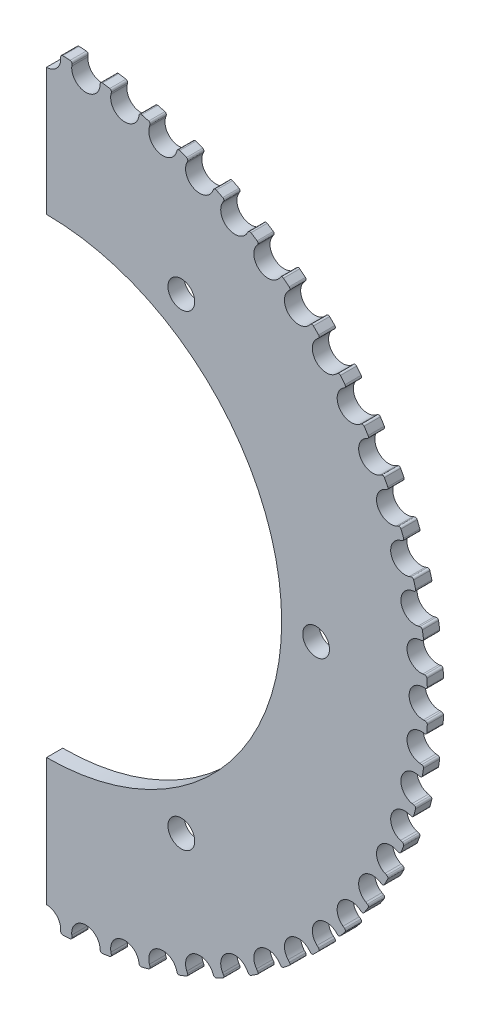
from build123d import *

# Parameters (mm, degrees)
SKETCH1_R                = 94
SKETCH1_R_2              = 58
BOSS_EXTRUDE1_DEPTH      = 4
CUT_EXTRUDE1_DEPTH       = 133.996240548
FILLET1_R                = 0.5
CIRPATTERN1_COUNT        = 60
FILLET1_OF_CIRPATTERN1_R = 0.5
M6_CLEARANCE_HOLE1_D     = 6.6
CIRPATTERN2_COUNT        = 6
CUT_EXTRUDE2_DEPTH       = 133.875237718
CUT_EXTRUDE2_DEPTH_BACK  = 133.875237718


with BuildPart() as part:
    # Sketch1 → Boss-Extrude1 (new body)
    with BuildSketch(Plane.XY):
        Circle(SKETCH1_R)
        Circle(SKETCH1_R_2, mode=Mode.SUBTRACT)
    extrude(amount=BOSS_EXTRUDE1_DEPTH)

    # Sketch2 → Cut-Extrude1 (cut, symmetric)
    with BuildSketch(Plane.XY):
        with BuildLine():
            Line((-3.5, 92.934817826), (-3.5, 93.934817826))
            ThreePointArc((-3.5, 93.934817826), (0, 94), (3.5, 93.934817826))
            Line((3.5, 93.934817826), (3.5, 92.934817826))
            ThreePointArc((3.5, 92.934817826), (0, 89.434817826), (-3.5, 92.934817826))
        make_face()
    cut_extrude1 = extrude(amount=CUT_EXTRUDE1_DEPTH, both=True, mode=Mode.SUBTRACT)

    # Fillet1
    fillet1_edges = [part.edges().sort_by_distance(p)[0] for p in [
        (3.5, 93.934817826, 2),
        (-3.5, 93.934817826, 2),
    ]]
    fillet(fillet1_edges, radius=FILLET1_R)

    # CirPattern1: Cut-Extrude1 ×60 about axis
    cirpattern1_axis = Axis((0, 0, 0), (0, 0, 1))
    for i in range(1, CIRPATTERN1_COUNT):
        add(cut_extrude1.rotate(cirpattern1_axis, i * 360 / CIRPATTERN1_COUNT), mode=Mode.SUBTRACT)

    # Fillet1 of CirPattern1
    fillet1_of_cirpattern1_edges = [part.edges().sort_by_distance(p)[0] for p in [
        (-6.338035521, 93.786082687, 2),
        (-13.299688788, 93.054383444, 2),
        (-16.106630198, 92.6098076, 2),
        (-22.953663403, 91.154425764, 2),
        (-25.698757265, 90.418880081, 2),
        (-32.356152879, 88.25576112, 2),
        (-35.009323369, 87.23730439, 2),
        (-41.404141572, 84.390147889, 2),
        (-43.93632, 83.099938537, 2),
        (-49.998497826, 79.599938537, 2),
        (-52.381941115, 78.052112368, 2),
        (-58.045060075, 73.937615602, 2),
        (-60.253654721, 72.149130922, 2),
        (-65.455668499, 67.465216677, 2),
        (-67.465216677, 65.455668499, 2),
        (-72.149130922, 60.253654721, 2),
        (-73.937615602, 58.045060075, 2),
        (-78.052112368, 52.381941115, 2),
        (-79.599938537, 49.998497826, 2),
        (-83.099938537, 43.93632, 2),
        (-84.390147889, 41.404141572, 2),
        (-87.23730439, 35.009323369, 2),
        (-88.25576112, 32.356152879, 2),
        (-90.418880081, 25.698757265, 2),
        (-91.154425764, 22.953663403, 2),
        (-92.6098076, 16.106630198, 2),
        (-93.054383444, 13.299688788, 2),
        (-93.786082687, 6.338035521, 2),
        (-93.934817826, 3.5, 2),
        (-93.934817826, -3.5, 2),
        (-93.786082687, -6.338035521, 2),
        (-93.054383444, -13.299688788, 2),
        (-92.6098076, -16.106630198, 2),
        (-91.154425764, -22.953663403, 2),
        (-90.418880081, -25.698757265, 2),
        (-88.25576112, -32.356152879, 2),
        (-87.23730439, -35.009323369, 2),
        (-84.390147889, -41.404141572, 2),
        (-83.099938537, -43.93632, 2),
        (-79.599938537, -49.998497826, 2),
        (-78.052112368, -52.381941115, 2),
        (-73.937615602, -58.045060075, 2),
        (-72.149130922, -60.253654721, 2),
        (-67.465216677, -65.455668499, 2),
        (-65.455668499, -67.465216677, 2),
        (-60.253654721, -72.149130922, 2),
        (-58.045060075, -73.937615602, 2),
        (-52.381941115, -78.052112368, 2),
        (-49.998497826, -79.599938537, 2),
        (-43.93632, -83.099938537, 2),
        (-41.404141572, -84.390147889, 2),
        (-35.009323369, -87.23730439, 2),
        (-32.356152879, -88.25576112, 2),
        (-25.698757265, -90.418880081, 2),
        (-22.953663403, -91.154425764, 2),
        (-16.106630198, -92.6098076, 2),
        (-13.299688788, -93.054383444, 2),
        (-6.338035521, -93.786082687, 2),
        (-3.5, -93.934817826, 2),
        (3.5, -93.934817826, 2),
        (6.338035521, -93.786082687, 2),
        (13.299688788, -93.054383444, 2),
        (16.106630198, -92.6098076, 2),
        (22.953663403, -91.154425764, 2),
        (25.698757265, -90.418880081, 2),
        (32.356152879, -88.25576112, 2),
        (35.009323369, -87.23730439, 2),
        (41.404141572, -84.390147889, 2),
        (43.93632, -83.099938537, 2),
        (49.998497826, -79.599938537, 2),
        (52.381941115, -78.052112368, 2),
        (58.045060075, -73.937615602, 2),
        (60.253654721, -72.149130922, 2),
        (65.455668499, -67.465216677, 2),
        (67.465216677, -65.455668499, 2),
        (72.149130922, -60.253654721, 2),
        (73.937615602, -58.045060075, 2),
        (78.052112368, -52.381941115, 2),
        (79.599938537, -49.998497826, 2),
        (83.099938537, -43.93632, 2),
        (84.390147889, -41.404141572, 2),
        (87.23730439, -35.009323369, 2),
        (88.25576112, -32.356152879, 2),
        (90.418880081, -25.698757265, 2),
        (91.154425764, -22.953663403, 2),
        (92.6098076, -16.106630198, 2),
        (93.054383444, -13.299688788, 2),
        (93.786082687, -6.338035521, 2),
        (93.934817826, -3.5, 2),
        (93.934817826, 3.5, 2),
        (93.786082687, 6.338035521, 2),
        (93.054383444, 13.299688788, 2),
        (92.6098076, 16.106630198, 2),
        (91.154425764, 22.953663403, 2),
        (90.418880081, 25.698757265, 2),
        (88.25576112, 32.356152879, 2),
        (87.23730439, 35.009323369, 2),
        (84.390147889, 41.404141572, 2),
        (83.099938537, 43.93632, 2),
        (79.599938537, 49.998497826, 2),
        (78.052112368, 52.381941115, 2),
        (73.937615602, 58.045060075, 2),
        (72.149130922, 60.253654721, 2),
        (67.465216677, 65.455668499, 2),
        (65.455668499, 67.465216677, 2),
        (60.253654721, 72.149130922, 2),
        (58.045060075, 73.937615602, 2),
        (52.381941115, 78.052112368, 2),
        (49.998497826, 79.599938537, 2),
        (43.93632, 83.099938537, 2),
        (41.404141572, 84.390147889, 2),
        (35.009323369, 87.23730439, 2),
        (32.356152879, 88.25576112, 2),
        (25.698757265, 90.418880081, 2),
        (22.953663403, 91.154425764, 2),
        (16.106630198, 92.6098076, 2),
        (13.299688788, 93.054383444, 2),
        (6.338035521, 93.786082687, 2),
    ]]
    fillet(fillet1_of_cirpattern1_edges, radius=FILLET1_OF_CIRPATTERN1_R)

    # M6 Clearance Hole1 (through all)
    with Locations(Plane.XY.offset(4)):
        with Locations((66.5, 0)):
            m6_clearance_hole1 = Hole(M6_CLEARANCE_HOLE1_D / 2)

    # CirPattern2: M6 Clearance Hole1 ×6 about axis
    cirpattern2_axis = Axis((0, 0, 0), (0, 0, 1))
    for i in range(1, CIRPATTERN2_COUNT):
        add(m6_clearance_hole1.rotate(cirpattern2_axis, i * 360 / CIRPATTERN2_COUNT), mode=Mode.SUBTRACT)

    # Sketch5 → Cut-Extrude2 (cut, two sides: drawn at the far end of the back side and taken through both)
    with BuildSketch(Plane.XY.offset(-CUT_EXTRUDE2_DEPTH_BACK)):
        Polygon((0, 611.582630855), (0, 125.058155116), (0, -117.448125393), (0, -603.972601132), (-973.048951478, -603.972601132), (-973.048951478, 611.582630855), align=None)
    extrude(amount=CUT_EXTRUDE2_DEPTH + CUT_EXTRUDE2_DEPTH_BACK, mode=Mode.SUBTRACT)


solid = part.part
